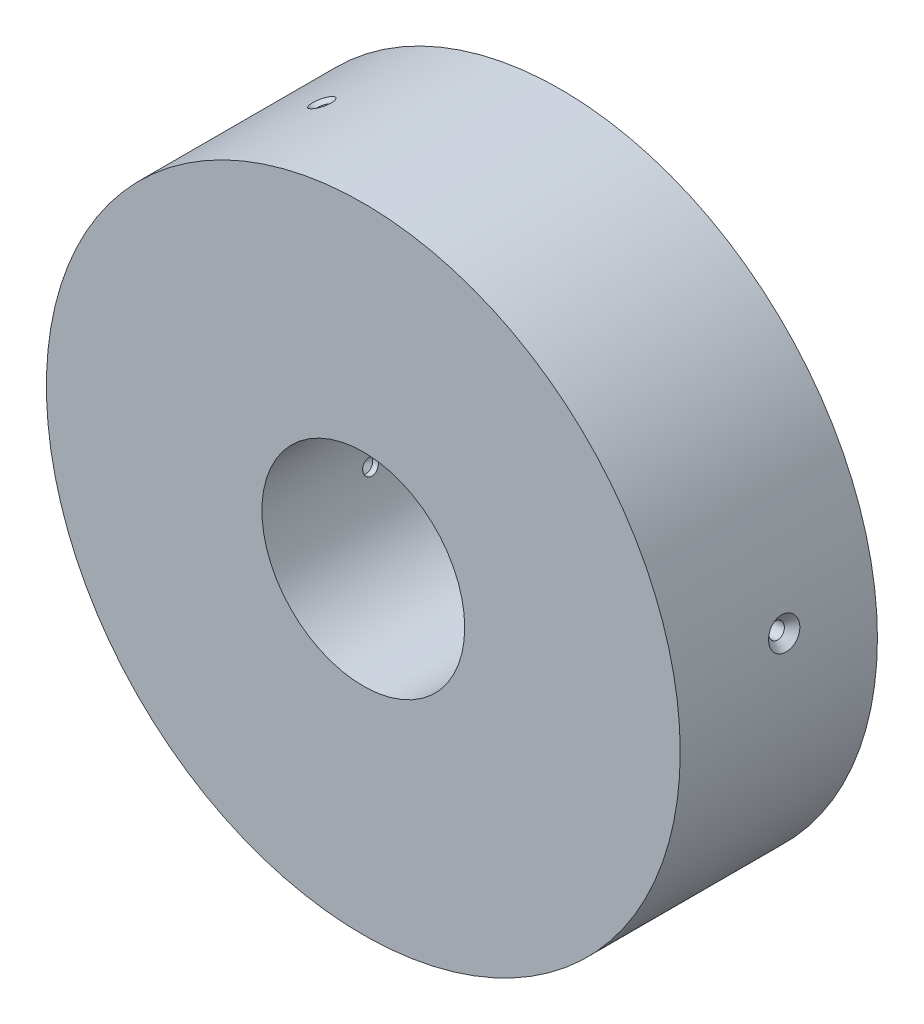
from build123d import *

# Parameters (mm, degrees)
SKETCH2_R                                         = 45
SKETCH2_R_2                                       = 14.4
BOSS_EXTRUDE1_DEPTH                               = 28
CSK_FOR_M2_FLAT_HEAD_MACHINE_SCREW2_D             = 2.2
CSK_FOR_M2_FLAT_HEAD_MACHINE_SCREW2_DEPTH         = 60.2
CSK_FOR_M2_FLAT_HEAD_MACHINE_SCREW2_CSINK_D       = 4.4
CSK_FOR_M2_FLAT_HEAD_MACHINE_SCREW2_CSINK_ANGLE   = 90
CSK_FOR_M2_FLAT_HEAD_MACHINE_SCREW2_TIP           = 0.660946681
CSK_FOR_0_FLAT_HEAD_MACHINE_SCREW_100_D           = 1.778
CSK_FOR_0_FLAT_HEAD_MACHINE_SCREW_100_DEPTH       = 60.2
CSK_FOR_0_FLAT_HEAD_MACHINE_SCREW_100_CSINK_D     = 3.0226
CSK_FOR_0_FLAT_HEAD_MACHINE_SCREW_100_CSINK_ANGLE = 100
CSK_FOR_0_FLAT_HEAD_MACHINE_SCREW_100_TIP         = 0.53416509


with BuildPart() as part:
    # Sketch2 → Boss-Extrude1 (new body)
    with BuildSketch(Plane.XY):
        Circle(SKETCH2_R)
        Circle(SKETCH2_R_2, mode=Mode.SUBTRACT)
    extrude(amount=BOSS_EXTRUDE1_DEPTH)

    # CSK for M2 Flat Head Machine Screw2
    with Locations(Plane(origin=(44.500938933, 6.683295151, 12.740574547), x_dir=(-0.148517670011, 0.98890975407, 0), z_dir=(0.98890975407, 0.148517670011, 0))):
        with Locations((-1e-09, 0)):
            CounterSinkHole(CSK_FOR_M2_FLAT_HEAD_MACHINE_SCREW2_D / 2, CSK_FOR_M2_FLAT_HEAD_MACHINE_SCREW2_CSINK_D / 2, depth=CSK_FOR_M2_FLAT_HEAD_MACHINE_SCREW2_DEPTH, counter_sink_angle=CSK_FOR_M2_FLAT_HEAD_MACHINE_SCREW2_CSINK_ANGLE)
            with Locations((0, 0, -(CSK_FOR_M2_FLAT_HEAD_MACHINE_SCREW2_DEPTH + CSK_FOR_M2_FLAT_HEAD_MACHINE_SCREW2_TIP / 2))):  # 118° drill point
                Cone(0, CSK_FOR_M2_FLAT_HEAD_MACHINE_SCREW2_D / 2, CSK_FOR_M2_FLAT_HEAD_MACHINE_SCREW2_TIP, mode=Mode.SUBTRACT)

    # CSK for #0 Flat Head Machine Screw (100)1
    with Locations(Plane(origin=(-19.959479504, 40.331367172, 13.936569292), x_dir=(0.896252603816, 0.443543988972, 0), z_dir=(-0.443543988972, 0.896252603816, 0))):
        with Locations((0, 0)):
            CounterSinkHole(CSK_FOR_0_FLAT_HEAD_MACHINE_SCREW_100_D / 2, CSK_FOR_0_FLAT_HEAD_MACHINE_SCREW_100_CSINK_D / 2, depth=CSK_FOR_0_FLAT_HEAD_MACHINE_SCREW_100_DEPTH, counter_sink_angle=CSK_FOR_0_FLAT_HEAD_MACHINE_SCREW_100_CSINK_ANGLE)
            with Locations((0, 0, -(CSK_FOR_0_FLAT_HEAD_MACHINE_SCREW_100_DEPTH + CSK_FOR_0_FLAT_HEAD_MACHINE_SCREW_100_TIP / 2))):  # 118° drill point
                Cone(0, CSK_FOR_0_FLAT_HEAD_MACHINE_SCREW_100_D / 2, CSK_FOR_0_FLAT_HEAD_MACHINE_SCREW_100_TIP, mode=Mode.SUBTRACT)


solid = part.part
